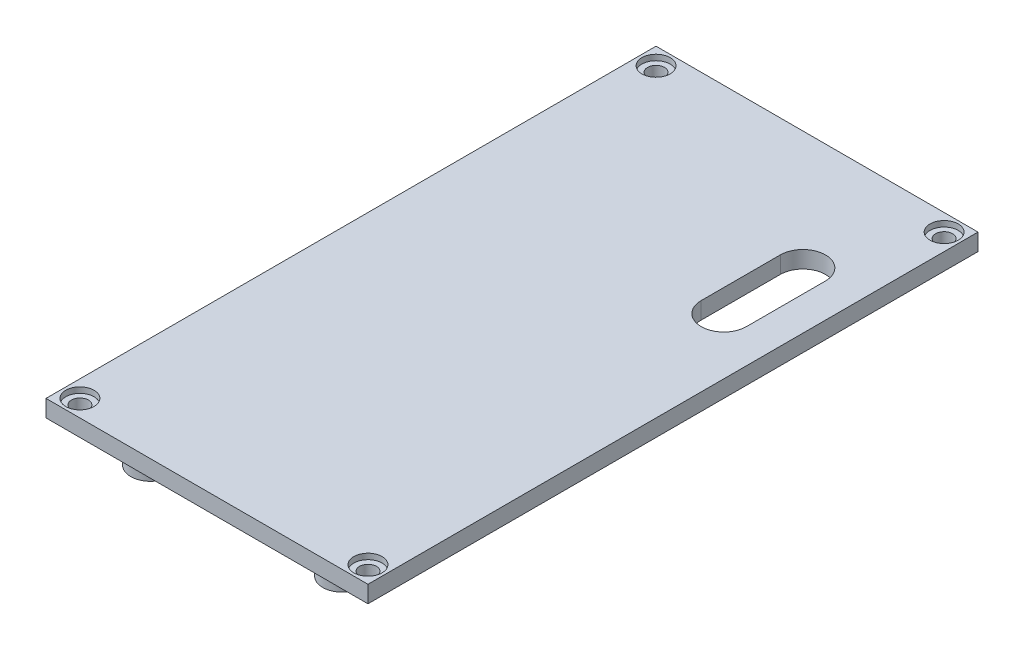
from build123d import *

# Parameters (mm, degrees)
CROQUIS1_W              = 57
CROQUIS1_H              = 108
SALIENTE_EXTRUIR1_DEPTH = 3
CROQUIS2_R              = 1.5
CORTAR_EXTRUIR1_DEPTH   = 3
CROQUIS3_R              = 2.5
CORTAR_EXTRUIR2_DEPTH   = 1
CROQUIS7_R              = 3.5
CROQUIS7_R_2            = 1.5
SALIENTE_EXTRUIR2_DEPTH = 5
CORTAR_EXTRUIR3_DEPTH   = 4


with BuildPart() as part:
    # Croquis1 → Saliente-Extruir1 (new body)
    with BuildSketch(Plane(origin=(0, 0, 0), x_dir=(1, 0, 0), z_dir=(0, 1, 0))):
        Rectangle(CROQUIS1_W, CROQUIS1_H)
    extrude(amount=SALIENTE_EXTRUIR1_DEPTH)

    # Croquis2 → Cortar-Extruir1 (cut)
    with BuildSketch(Plane(origin=(0, 3, 0), x_dir=(1, 0, 0), z_dir=(0, 1, 0))):
        with Locations(Location((-25.5, 51, 0), (0, 0, 270))):
            Circle(CROQUIS2_R)
        with Locations(Location((25.5, 51, 0), (0, 0, 270))):
            Circle(CROQUIS2_R)
        with Locations(Location((25.5, -51, 0), (0, 0, 270))):
            Circle(CROQUIS2_R)
        with Locations(Location((-25.5, -51, 0), (0, 0, 270))):
            Circle(CROQUIS2_R)
    extrude(amount=-CORTAR_EXTRUIR1_DEPTH, mode=Mode.SUBTRACT)

    # Croquis3 → Cortar-Extruir2 (cut)
    with BuildSketch(Plane(origin=(0, 3, 0), x_dir=(1, 0, 0), z_dir=(0, 1, 0))):
        with Locations(Location((-25.5, 51, 0), (0, 0, 270))):
            Circle(CROQUIS3_R)
        with Locations(Location((25.5, 51, 0), (0, 0, 270))):
            Circle(CROQUIS3_R)
        with Locations(Location((25.5, -51, 0), (0, 0, 270))):
            Circle(CROQUIS3_R)
        with Locations(Location((-25.5, -51, 0), (0, 0, 270))):
            Circle(CROQUIS3_R)
    extrude(amount=-CORTAR_EXTRUIR2_DEPTH, mode=Mode.SUBTRACT)

    # Croquis7 → Saliente-Extruir2 (add)
    # profile 1 of 4: a face of its own
    with BuildSketch(Plane.XZ):
        with Locations(Location((-17, 47, 0), (0, 0, 90))):
            Circle(CROQUIS7_R)
        with Locations(Location((-17, 47, 0), (0, 0, 270))):
            Circle(CROQUIS7_R_2, mode=Mode.SUBTRACT)
    # profile 2 of 4: a face of its own
    with BuildSketch(Plane.XZ):
        with Locations(Location((17, 47, 0), (0, 0, 90))):
            Circle(CROQUIS7_R)
        with Locations(Location((17, 47, 0), (0, 0, 270))):
            Circle(CROQUIS7_R_2, mode=Mode.SUBTRACT)
    # profile 3 of 4: a face of its own
    with BuildSketch(Plane.XZ):
        with Locations(Location((17, -47, 0), (0, 0, 90))):
            Circle(CROQUIS7_R)
        with Locations(Location((17, -47, 0), (0, 0, 270))):
            Circle(CROQUIS7_R_2, mode=Mode.SUBTRACT)
    # profile 4 of 4: a face of its own
    with BuildSketch(Plane.XZ):
        with Locations(Location((-17, -47, 0), (0, 0, 90))):
            Circle(CROQUIS7_R)
        with Locations(Location((-17, -47, 0), (0, 0, 270))):
            Circle(CROQUIS7_R_2, mode=Mode.SUBTRACT)
    extrude(amount=SALIENTE_EXTRUIR2_DEPTH)

    # Croquis9 → Cortar-Extruir3 (cut)
    with BuildSketch(Plane(origin=(0, 3, 0), x_dir=(1, 0, 0), z_dir=(0, 1, 0))):
        with BuildLine():
            Line((14.5, 33), (14.5, 19))
            ThreePointArc((14.5, 19), (18.5, 15), (22.5, 19))
            Line((22.5, 19), (22.5, 33))
            ThreePointArc((22.5, 33), (18.5, 37), (14.5, 33))
        make_face()
    extrude(amount=-CORTAR_EXTRUIR3_DEPTH, mode=Mode.SUBTRACT)


solid = part.part
